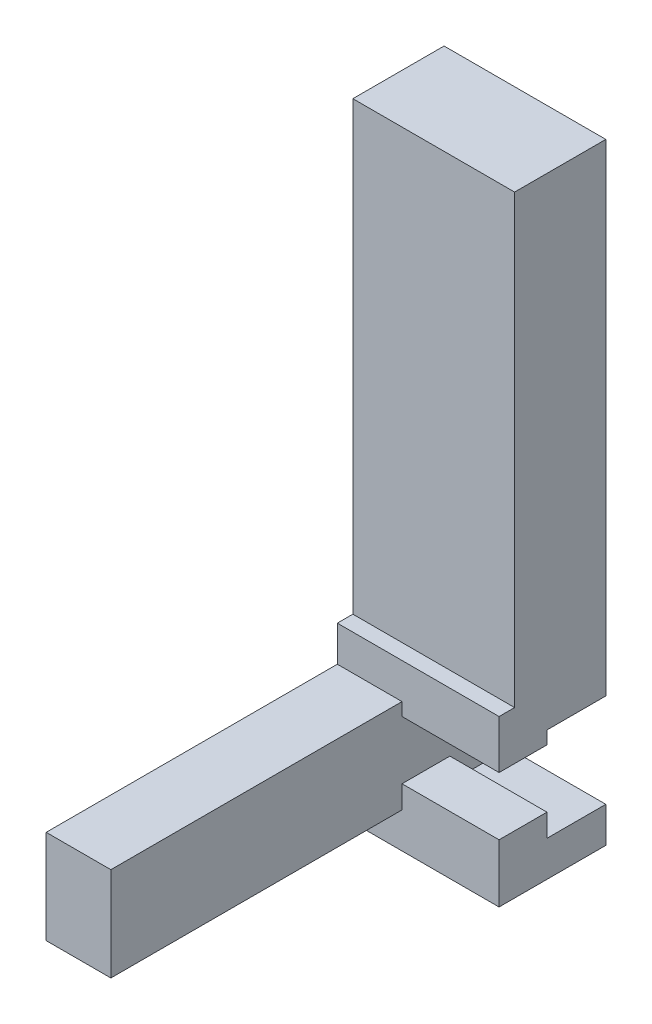
from build123d import *

# Parameters (mm, degrees)
SKETCH_1_W      = 2
SKETCH_1_H      = 12
EXTRUDE_1_DEPTH = 2.9
EXTRUDE_START   = -2
SKETCH_2_W      = 1.48
SKETCH_2_H      = 1.5
SKETCH_2_H_2    = 1.8
EXTRUDE_2_DEPTH = 5
SKETCH_3_W      = 9
SKETCH_3_H      = 2.9
EXTRUDE_3_DEPTH = 2
EXTRUDE_START_2 = -5.1
SKETCH_4_W      = 2
SKETCH_4_H      = 2
EXTRUDE_4_DEPTH = 18.9
SKETCH_5_W      = 2.82
SKETCH_5_H      = 14.9
SKETCH_5_H_2    = 1.1
EXTRUDE_5_DEPTH = 5


with BuildPart() as part:
    # 草图1 → 凸台-拉伸1 (new body)
    with BuildSketch(Plane(origin=(0, 0, 0), x_dir=(1, 0, 0), z_dir=(0, 1, 0))):
        Rectangle(SKETCH_1_W, SKETCH_1_H)
    extrude(amount=EXTRUDE_1_DEPTH)

    # 草图2 → 凸台-拉伸2 (add)
    with BuildSketch(Plane(origin=(1, 0, 0), x_dir=(0, 0, -1), z_dir=(1, 0, 0)).offset(EXTRUDE_START)):
        with Locations((3.44, 3.25)):
            Rectangle(SKETCH_2_W, SKETCH_2_H)
        with Locations((3.44, -0.2)):
            Rectangle(SKETCH_2_W, SKETCH_2_H_2)
    extrude(amount=EXTRUDE_2_DEPTH)

    # 草图3 → 凸台-拉伸3 (add)
    with BuildSketch(Plane.ZY.offset(1)):
        with Locations((1.8, 1.45)):
            Rectangle(SKETCH_3_W, SKETCH_3_H)
    extrude(amount=-EXTRUDE_3_DEPTH)

    # 草图4 → 凸台-拉伸4 (add)
    with BuildSketch(Plane(origin=(0, 4, 0), x_dir=(1, 0, 0), z_dir=(0, 1, 0)).offset(EXTRUDE_START_2)):
        with Locations((0, 4.18)):
            Rectangle(SKETCH_4_W, SKETCH_4_H)
    extrude(amount=EXTRUDE_4_DEPTH)

    # 草图5 → 凸台-拉伸5 (add)
    with BuildSketch(Plane(origin=(1, 0, 0), x_dir=(0, 0, -1), z_dir=(1, 0, 0)).offset(EXTRUDE_START)):
        with Locations((4.59, 10.35)):
            Rectangle(SKETCH_5_W, SKETCH_5_H)
        with Locations((4.59, -0.55)):
            Rectangle(SKETCH_5_W, SKETCH_5_H_2)
    extrude(amount=EXTRUDE_5_DEPTH)


solid = part.part
